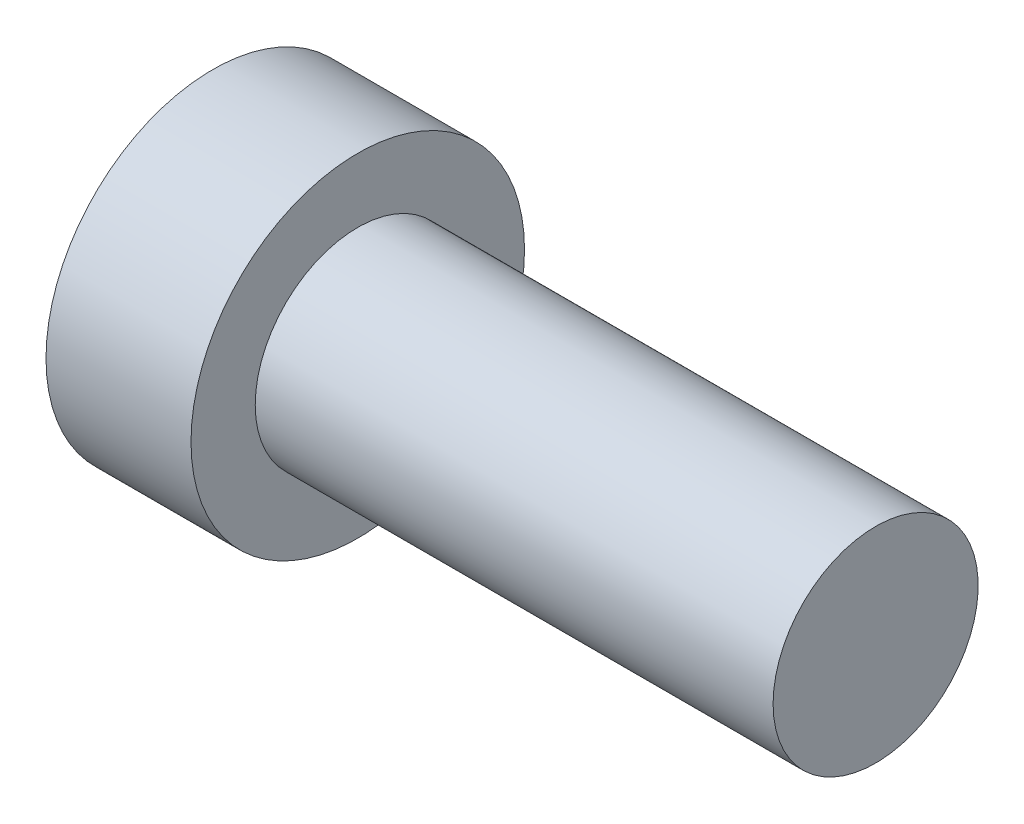
from build123d import *

# Parameters (mm, degrees)
CIRPATTERN1_COUNT = 2
CIRPATTERN1_ANGLE = 90


with BuildPart() as part:
    # BodySke → Base-Revolve (revolve)
    with BuildSketch(Plane.XY, mode=Mode.PRIVATE) as base_revolve_sk:
        with BuildLine():
            Line((2.413, 1.2573), (2.413, 2.0447))
            Line((2.413, 2.0447), (0.635, 2.0447))
            ThreePointArc((0.635, 2.0447), (0.162403576, 1.070516591), (0, 0))
            Line((0, 0), (8.763, 0))
            Line((8.763, 0), (8.763, 1.2573))
            Line((8.763, 1.2573), (2.413, 1.2573))
        make_face()
    revolve(base_revolve_sk.sketch.rotate(Axis((-25.4, 0, 0), (1, 0, 0)), 90), axis=Axis((-25.4, 0, 0), (1, 0, 0)))

    # Sketch3 → Cross section 0
    with BuildSketch(Plane(origin=(0, 0, 0), x_dir=(0, 0, -1), z_dir=(1, 0, 0))):
        with BuildLine():
            Line((0.3429, -1.5367), (-0.3429, -1.5367))
            Line((-0.3429, -1.5367), (-0.3429, 1.5367))
            Line((-0.3429, 1.5367), (0.3429, 1.5367))
            Line((0.3429, 1.5367), (0.3429, -1.5367))
        make_face()
    # Sketch4 → Cross section 1
    with BuildSketch(Plane(origin=(1.7018, 0, 0), x_dir=(0, 0, -1), z_dir=(1, 0, 0))):
        with BuildLine():
            Line((0.17145, -0.17145), (-0.17145, -0.17145))
            Line((-0.17145, -0.17145), (-0.17145, 0.17145))
            Line((-0.17145, 0.17145), (0.17145, 0.17145))
            Line((0.17145, 0.17145), (0.17145, -0.17145))
        make_face()
    cross = loft(mode=Mode.SUBTRACT)

    # CirPattern1: Cross ×2 about axis
    cirpattern1_axis = Axis((0, 0, 0), (1, 0, 0))
    for i in range(1, CIRPATTERN1_COUNT):
        add(cross.rotate(cirpattern1_axis, i * CIRPATTERN1_ANGLE / (CIRPATTERN1_COUNT - 1)), mode=Mode.SUBTRACT)


solid = part.part
